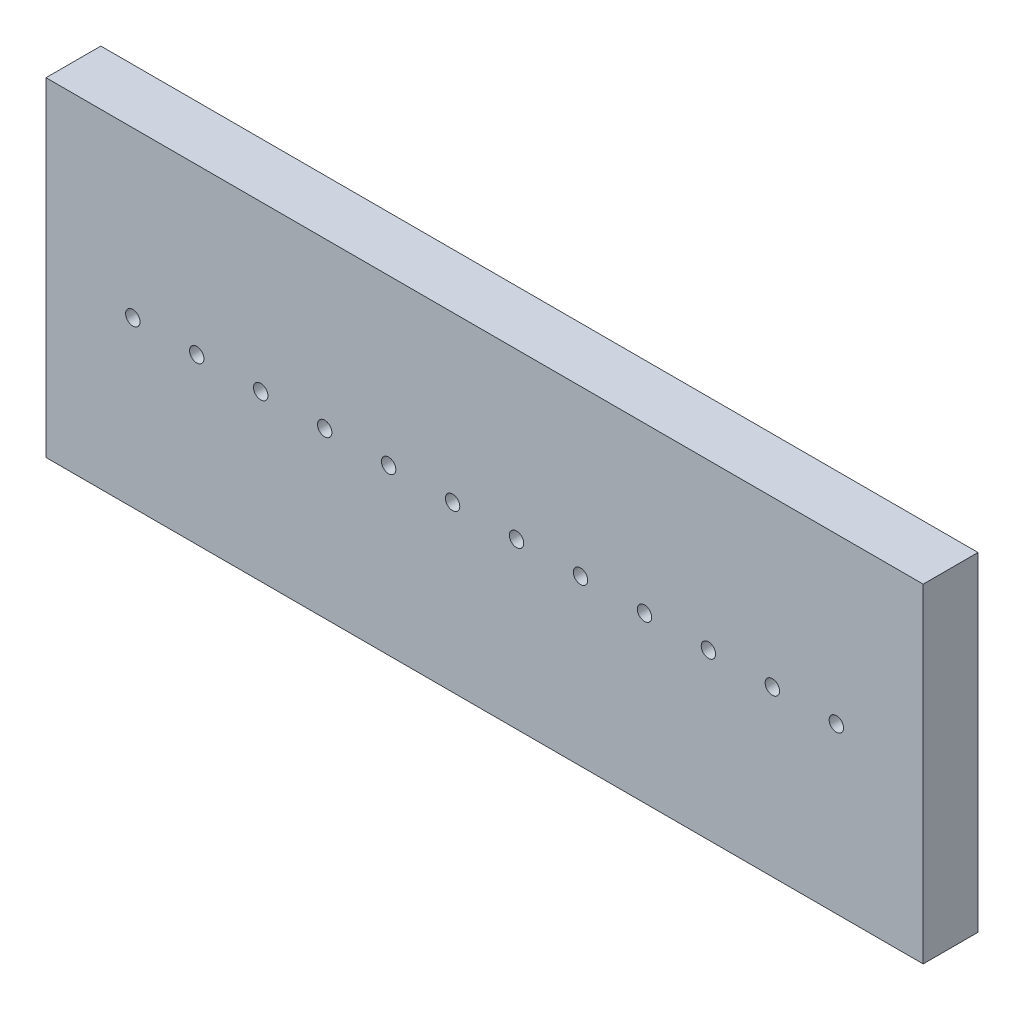
from build123d import *

# Parameters (mm, degrees)
ESQUISSE1_W             = 203.2
ESQUISSE1_H             = 76.2
BOSS_EXTRU_1_DEPTH      = 12.7
ESQUISSE2_R             = 1.666875
ENL_V_MAT_EXTRU_1_DEPTH = 110.249530891


with BuildPart() as part:
    # Esquisse1 → Boss.-Extru.1 (new body)
    with BuildSketch(Plane.XY):
        Rectangle(ESQUISSE1_W, ESQUISSE1_H)
    extrude(amount=BOSS_EXTRU_1_DEPTH)

    # Esquisse2 → Enlèv. mat.-Extru.1 (cut, through all)
    with BuildSketch(Plane(origin=(0, 0, 0), x_dir=(-1, 0, 0), z_dir=(0, 0, -1))):
        with Locations((81.49209, 0)):
            Circle(ESQUISSE2_R)
        with Locations((66.67627, 0)):
            Circle(ESQUISSE2_R)
        with Locations((51.86045, 0)):
            Circle(ESQUISSE2_R)
        with Locations((37.04463, 0)):
            Circle(ESQUISSE2_R)
        with Locations((22.22881, 0)):
            Circle(ESQUISSE2_R)
        with Locations((7.41299, 0)):
            Circle(ESQUISSE2_R)
        with Locations((-7.40283, 0)):
            Circle(ESQUISSE2_R)
        with Locations((-22.21865, 0)):
            Circle(ESQUISSE2_R)
        with Locations((-37.03447, 0)):
            Circle(ESQUISSE2_R)
        with Locations((-51.85029, 0)):
            Circle(ESQUISSE2_R)
        with Locations((-66.66611, 0)):
            Circle(ESQUISSE2_R)
        with Locations((-81.48193, 0)):
            Circle(ESQUISSE2_R)
    extrude(amount=-ENL_V_MAT_EXTRU_1_DEPTH, mode=Mode.SUBTRACT)


solid = part.part
